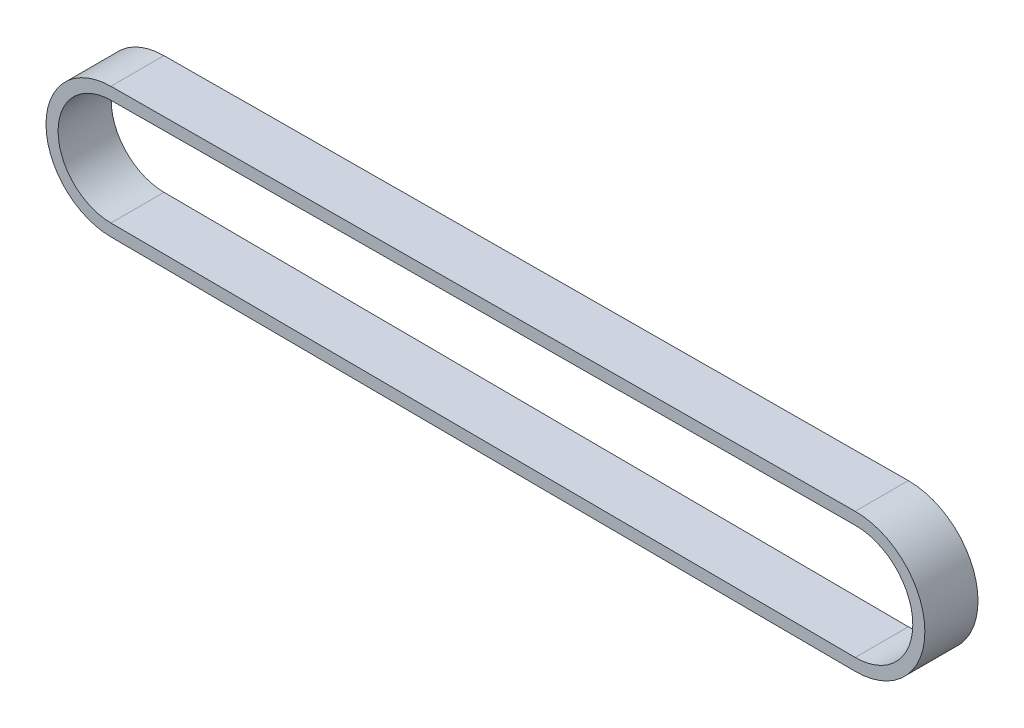
from build123d import *

# Parameters (mm, degrees)
BOSS_EXTRUDE1_DEPTH = 11


with BuildPart() as part:
    # Sketch2 → Boss-Extrude1 (new body)
    with BuildSketch(Plane.XY):
        with BuildLine():
            Line((-77.124464631, 13.499794629), (76.97084685, 14.349781698))
            ThreePointArc((76.97084685, 14.349781698), (91.399999997, 0), (76.97084685, -14.349781698))
            Line((76.97084685, -14.349781698), (-77.124464631, -13.499794629))
            ThreePointArc((-77.124464631, -13.499794629), (-90.549999997, 0), (-77.124464631, 13.499794629))
        make_face()
        with BuildLine():
            Line((-77.110674884, 10.99983266), (76.984636597, 11.84981973))
            ThreePointArc((76.984636597, 11.84981973), (88.899999997, 0), (76.984636597, -11.84981973))
            Line((76.984636597, -11.84981973), (-77.110674884, -10.99983266))
            ThreePointArc((-77.110674884, -10.99983266), (-88.049999997, 0), (-77.110674884, 10.99983266))
        make_face(mode=Mode.SUBTRACT)
    extrude(amount=BOSS_EXTRUDE1_DEPTH)


solid = part.part
